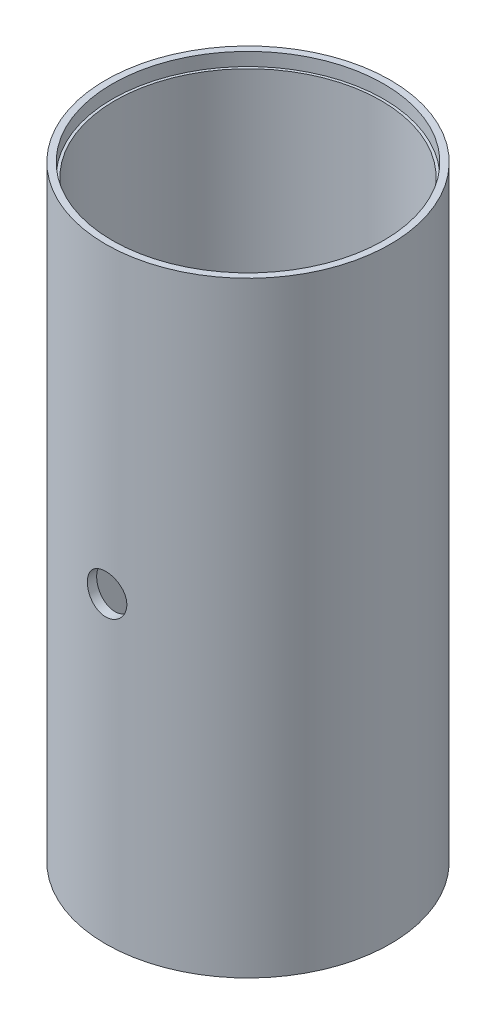
from build123d import *

# Parameters (mm, degrees)
SKETCH_1_R          = 54
SKETCH_1_R_2        = 50.5
EXTRUDE_1_DEPTH     = 230
SKETCH_2_R          = 51.5
CUT_EXTRUDE_1_DEPTH = 5
SKETCH_3_R          = 7.5
CUT_EXTRUDE_2_DEPTH = 101


with BuildPart() as part:
    # Эскиз1 → Бобышка-Вытянуть1 (new body)
    with BuildSketch(Plane(origin=(0, 0, 0), x_dir=(1, 0, 0), z_dir=(0, 1, 0))):
        with Locations(Location((0, 0, 0), (0, 0, 270))):
            Circle(SKETCH_1_R)
        with Locations(Location((0, 0, 0), (0, 0, 270))):
            Circle(SKETCH_1_R_2, mode=Mode.SUBTRACT)
    extrude(amount=EXTRUDE_1_DEPTH)

    # Эскиз2 → Вырез-Вытянуть1 (cut)
    with BuildSketch(Plane(origin=(0, 230, 0), x_dir=(1, 0, 0), z_dir=(0, 1, 0))):
        with Locations(Location((0, 0, 0), (0, 0, 270))):
            Circle(SKETCH_2_R)
    extrude(amount=-CUT_EXTRUDE_1_DEPTH, mode=Mode.SUBTRACT)

    # Эскиз3 → Вырез-Вытянуть2 (cut)
    with BuildSketch(Plane.XY):
        with Locations(Location((0, 115, 0), (0, 0, 180))):
            Circle(SKETCH_3_R)
    extrude(amount=CUT_EXTRUDE_2_DEPTH, mode=Mode.SUBTRACT)


solid = part.part
